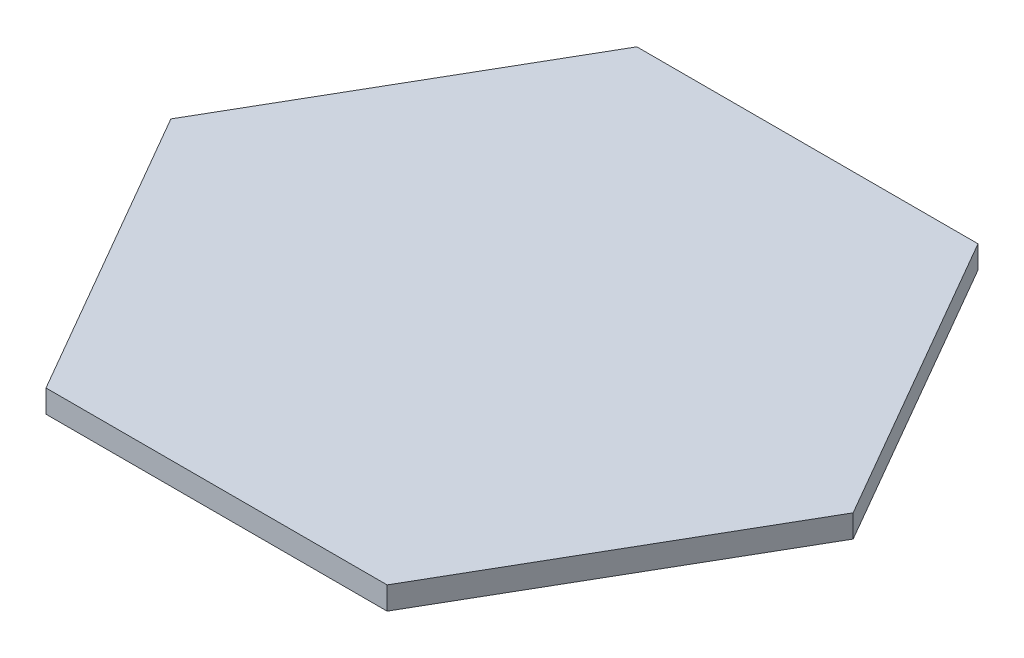
from build123d import *

# Parameters (mm, degrees)
EXTRUDE_1_DEPTH = 2


with BuildPart() as part:
    # 草图1 → 凸台-拉伸1 (new body)
    with BuildSketch(Plane(origin=(0, 0, 0), x_dir=(1, 0, 0), z_dir=(0, 1, 0))):
        Polygon((30, 0), (15, 25.980762114), (-15, 25.980762114), (-30, 0), (-15, -25.980762114), (15, -25.980762114), align=None)
    extrude(amount=EXTRUDE_1_DEPTH)


solid = part.part
